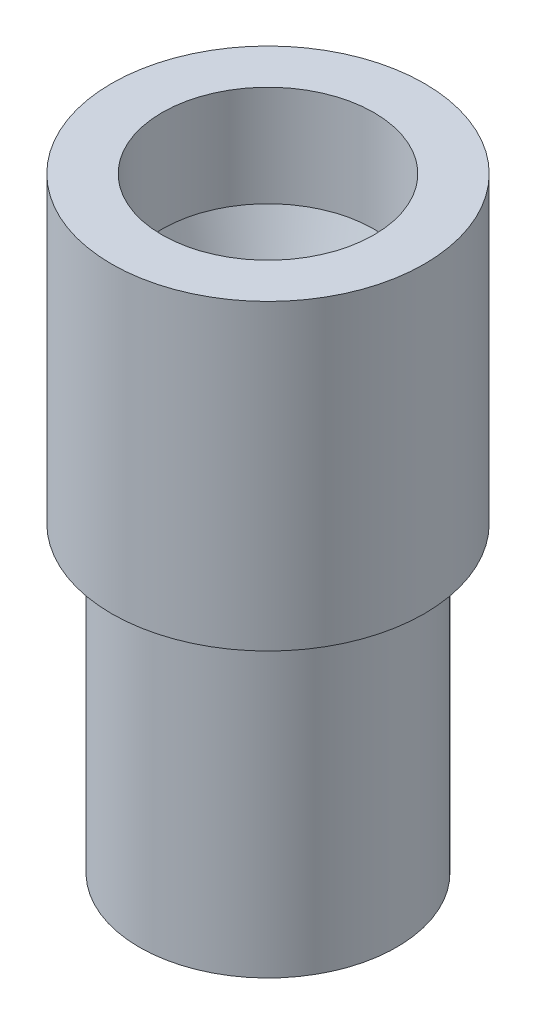
from build123d import *

# Parameters (mm, degrees)
SKETCH1_R           = 6.375
BOSS_EXTRUDE1_DEPTH = 15
SKETCH9_R           = 7.75
BOSS_EXTRUDE5_DEPTH = 15
SKETCH10_R          = 5.25
CUT_EXTRUDE4_DEPTH  = 5
SKETCH11_R          = 5.25
CUT_EXTRUDE5_DEPTH  = 10
CUT_EXTRUDE5_DRAFT  = -20
SKETCH12_R          = 3.875
CUT_EXTRUDE6_DEPTH  = 30


with BuildPart() as part:
    # Sketch1 → Boss-Extrude1 (new body)
    with BuildSketch(Plane(origin=(0, 0, 0), x_dir=(1, 0, 0), z_dir=(0, 1, 0))):
        with Locations(Location((0, 0, 0), (0, 0, 270))):
            Circle(SKETCH1_R)
    extrude(amount=BOSS_EXTRUDE1_DEPTH)

    # Sketch9 → Boss-Extrude5 (add)
    with BuildSketch(Plane(origin=(0, 15, 0), x_dir=(1, 0, 0), z_dir=(0, 1, 0))):
        with Locations(Location((0, 0, 0), (0, 0, 270))):
            Circle(SKETCH9_R)
    extrude(amount=BOSS_EXTRUDE5_DEPTH)

    # Sketch10 → Cut-Extrude4 (cut)
    with BuildSketch(Plane(origin=(0, 30, 0), x_dir=(1, 0, 0), z_dir=(0, 1, 0))):
        with Locations(Location((0, 0, 0), (0, 0, 270))):
            Circle(SKETCH10_R)
    extrude(amount=-CUT_EXTRUDE4_DEPTH, mode=Mode.SUBTRACT)


with BuildPart() as cut_extrude5_tool:
    # Sketch11 → Cut-Extrude5 (with draft: the straight prism first)
    with BuildSketch(Plane(origin=(0, 25, 0), x_dir=(1, 0, 0), z_dir=(0, 1, 0))):
        with Locations(Location((0, 0, 0), (0, 0, 270))):
            Circle(SKETCH11_R)
    extrude(amount=-CUT_EXTRUDE5_DEPTH)
    # Cut-Extrude5: the draft: its side faces are tilted about the plane it starts from
    cut_extrude5_sides = [cut_extrude5_tool.faces().sort_by_distance(p)[0] for p in [
        (0, 20, -5.25),
    ]]
    draft(cut_extrude5_sides, Plane(origin=(0, 25, 0), x_dir=(1, 0, 0), z_dir=(0, 1, 0)), CUT_EXTRUDE5_DRAFT)


with BuildPart() as part_1:
    add(part.part)

    # Cut-Extrude5: cut by cut_extrude5_tool
    add(cut_extrude5_tool.part, mode=Mode.SUBTRACT)

    # Sketch12 → Cut-Extrude6 (cut)
    with BuildSketch(Plane.XZ):
        with Locations(Location((0, 0, 0), (0, 0, 270))):
            Circle(SKETCH12_R)
    extrude(amount=-CUT_EXTRUDE6_DEPTH, mode=Mode.SUBTRACT)


solid = part_1.part
